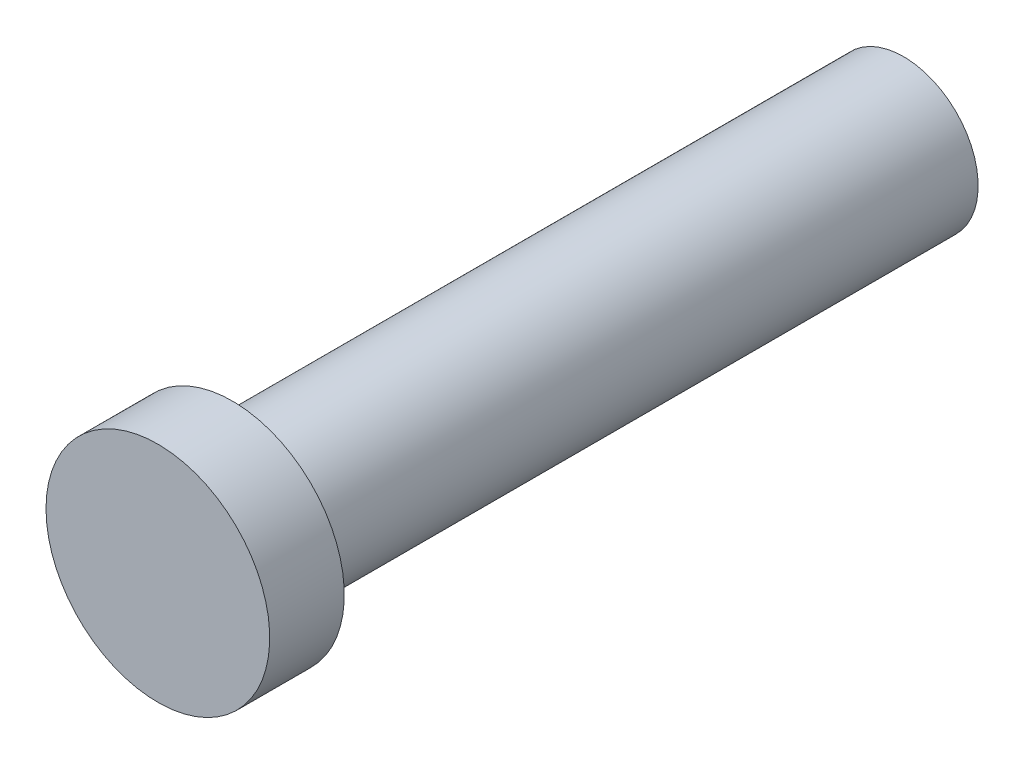
from build123d import *

# Parameters (mm, degrees)
SKICA1_R                = 5
P_IDAT_VYSUNUT_M1_DEPTH = 45
SKICA2_R                = 7.5
P_IDAT_VYSUNUT_M2_DEPTH = 5


with BuildPart() as part:
    # Skica1 → Přidat vysunutím1 (new body)
    with BuildSketch(Plane.XY):
        with Locations(Location((0, 0, 0), (0, 0, 180))):
            Circle(SKICA1_R)
    extrude(amount=P_IDAT_VYSUNUT_M1_DEPTH)

    # Skica2 → Přidat vysunutím2 (add)
    with BuildSketch(Plane.XY.offset(45)):
        with Locations(Location((0, 0, 0), (0, 0, 180))):
            Circle(SKICA2_R)
    extrude(amount=P_IDAT_VYSUNUT_M2_DEPTH)


solid = part.part
